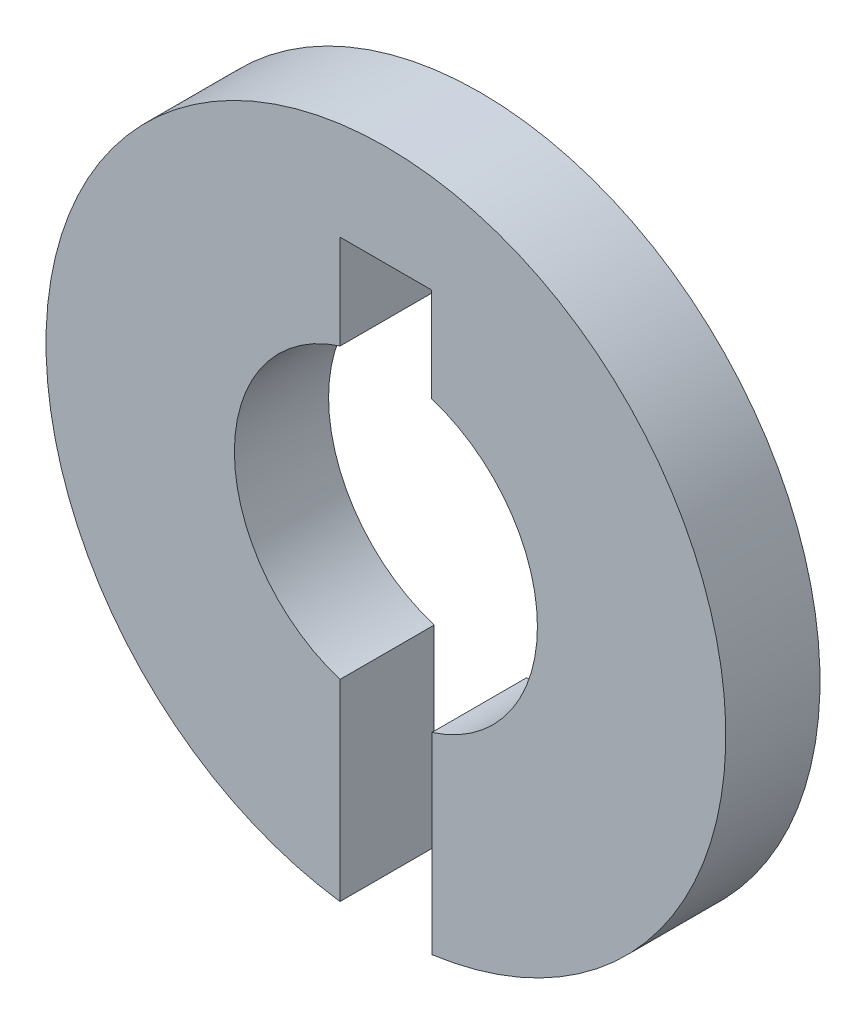
from build123d import *

# Parameters (mm, degrees)
EXTRUDE_1_DEPTH = 3


with BuildPart() as part:
    # 스케치1 → 보스-돌출1 (new body)
    with BuildSketch(Plane.XY):
        with BuildLine():
            Line((-1.455, 7.601440101), (1.455, 7.601440101))
            Line((1.455, 7.601440101), (1.455, 4.601440101))
            ThreePointArc((1.455, 4.601440101), (4.825998397, 0.003934023), (1.4625, -4.599061834))
            Line((1.4625, -4.599061834), (1.4625, -10.726759518))
            ThreePointArc((1.4625, -10.726759518), (0, 10.826), (-1.4625, -10.726759518))
            Line((-1.4625, -10.726759518), (-1.4625, -4.599061834))
            ThreePointArc((-1.4625, -4.599061834), (-4.825998397, 0.003934023), (-1.455, 4.601440101))
            Line((-1.455, 4.601440101), (-1.455, 7.601440101))
        make_face()
    extrude(amount=EXTRUDE_1_DEPTH)


solid = part.part
